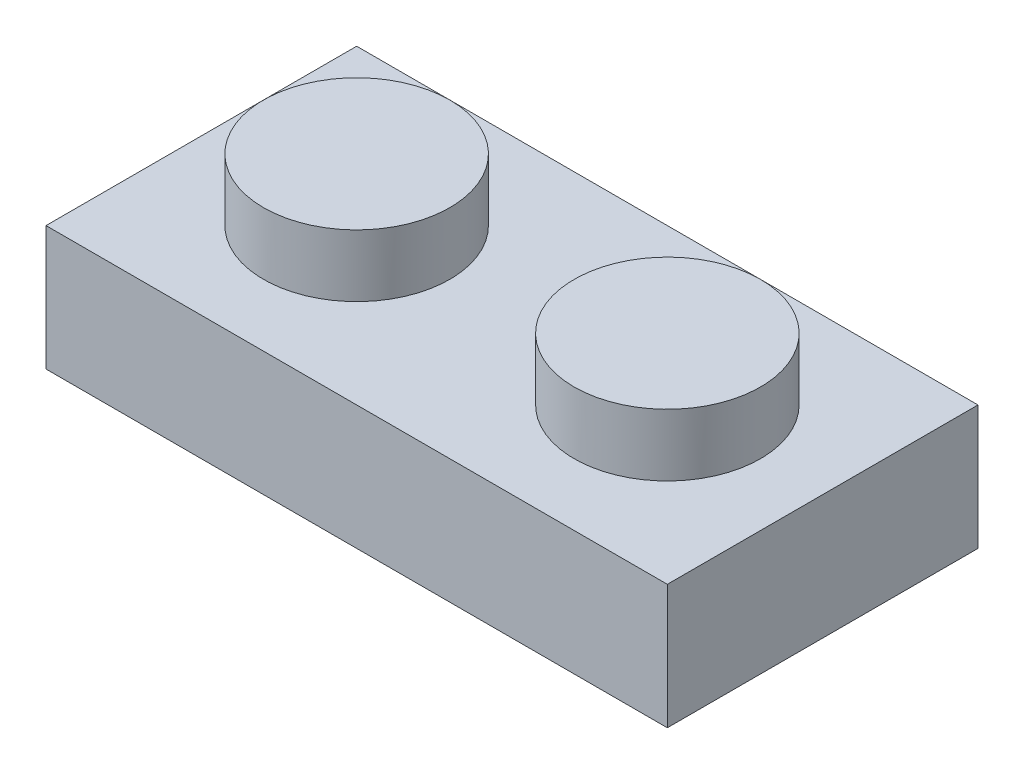
from build123d import *

# Parameters (mm, degrees)
SKETCH1_W            = 16
SKETCH1_H            = 8
BOSS_EXTRUDE1_DEPTH  = 3.2
SKETCH2_R            = 2.4
BOSS_EXTRUDE2_DEPTH  = 1.6
LPATTERN1_COUNT      = 2
LPATTERN1_PITCH      = 8
LPATTERN1_COUNT_DIR2 = 4
LPATTERN1_PITCH_DIR2 = 8
SHELL1_T             = -1.6


with BuildPart() as part:
    # Sketch1 → Boss-Extrude1 (new body)
    with BuildSketch(Plane(origin=(0, 0, 0), x_dir=(1, 0, 0), z_dir=(0, 1, 0))):
        with Locations((8, 4)):
            Rectangle(SKETCH1_W, SKETCH1_H)
    extrude(amount=BOSS_EXTRUDE1_DEPTH)

    # Sketch2 → Boss-Extrude2 (add)
    with BuildSketch(Plane(origin=(0, 3.2, 0), x_dir=(1, 0, 0), z_dir=(0, 1, 0))):
        with Locations(Location((12, 4, 0), (0, 0, 90))):
            Circle(SKETCH2_R)
    boss_extrude2 = extrude(amount=BOSS_EXTRUDE2_DEPTH)

    # LPattern1: Boss-Extrude2 2 × 4, 6 skipped
    with Locations(*[(-i * LPATTERN1_PITCH, 0, -j * LPATTERN1_PITCH_DIR2) for i in range(LPATTERN1_COUNT) for j in range(LPATTERN1_COUNT_DIR2) if (i, j) not in ((0, 0), (0, 1), (0, 2), (0, 3), (1, 1), (1, 2), (1, 3))]):
        add(boss_extrude2)

    # Shell1
    shell1_openings = [part.faces().sort_by_distance(p)[0] for p in [
        (8, 0, -4),
    ]]
    offset(amount=SHELL1_T, openings=shell1_openings, kind=Kind.INTERSECTION)


solid = part.part
